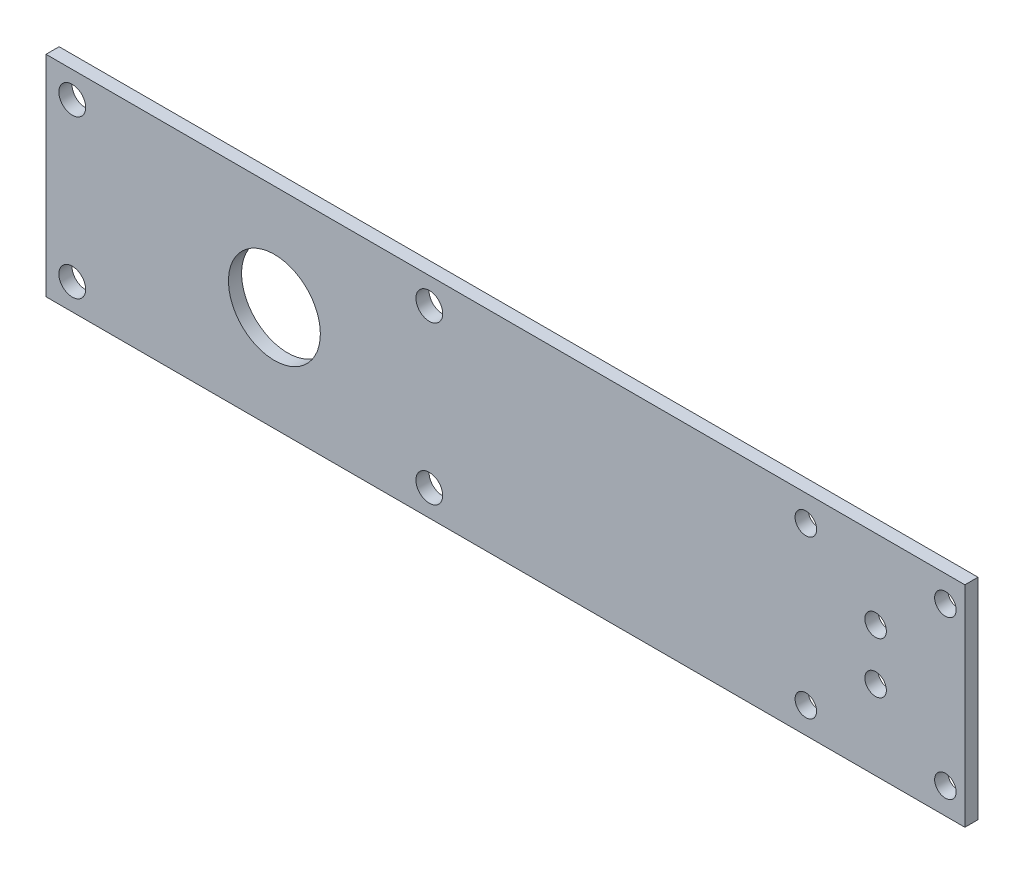
from build123d import *

# Parameters (mm, degrees)
SKETCH1_W           = 350
SKETCH1_H           = 80
BOSS_EXTRUDE1_DEPTH = 5
SKETCH2_R           = 17.5
CUT_EXTRUDE1_DEPTH  = 60
SKETCH3_R           = 5.1
CUT_EXTRUDE2_DEPTH  = 10
SKETCH5_R           = 4.1
CUT_EXTRUDE3_DEPTH  = 267.071418984
SKETCH7_R           = 4.1
CUT_EXTRUDE5_DEPTH  = 267.071418984


with BuildPart() as part:
    # Sketch1 → Boss-Extrude1 (new body)
    with BuildSketch(Plane.XY):
        with Locations((88, 0)):
            Rectangle(SKETCH1_W, SKETCH1_H)
    extrude(amount=BOSS_EXTRUDE1_DEPTH)

    # Sketch2 → Cut-Extrude1 (cut)
    with BuildSketch(Plane(origin=(211.325798344, -35.262222233, -13.242737988), x_dir=(1, 0, 0), z_dir=(0, 0, 1))):
        with Locations((-211.325798344, 35.262222233)):
            Circle(SKETCH2_R)
    extrude(amount=CUT_EXTRUDE1_DEPTH, mode=Mode.SUBTRACT)

    # Sketch3 → Cut-Extrude2 (cut)
    with BuildSketch(Plane(origin=(20.819518943, -63.639721452, 0), x_dir=(1, 0, 0), z_dir=(0, 0, 1))):
        with Locations((-97.819518943, 93.639721452)):
            Circle(SKETCH3_R)
        with Locations(Location((38.180481057, 33.639721452, 0), (0, 0, 180))):
            Circle(SKETCH3_R)
        with Locations((38.180481057, 93.639721452)):
            Circle(SKETCH3_R)
        with Locations(Location((-97.819518943, 33.639721452, 0), (0, 0, 180))):
            Circle(SKETCH3_R)
    extrude(amount=CUT_EXTRUDE2_DEPTH, mode=Mode.SUBTRACT)

    # Sketch5 → Cut-Extrude3 (cut, through all)
    with BuildSketch(Plane.XY):
        with Locations((229, 9.75)):
            Circle(SKETCH5_R)
        with Locations((229, -9.75)):
            Circle(SKETCH5_R)
    extrude(amount=CUT_EXTRUDE3_DEPTH, mode=Mode.SUBTRACT)

    # Sketch7 → Cut-Extrude5 (cut, through all)
    with BuildSketch(Plane.XY):
        with Locations((202.42, 30)):
            Circle(SKETCH7_R)
        with Locations(Location((202.42, -30, 0), (0, 0, 180))):
            Circle(SKETCH7_R)
        with Locations((255.58, -30)):
            Circle(SKETCH7_R)
        with Locations(Location((255.58, 30, 0), (0, 0, 180))):
            Circle(SKETCH7_R)
    extrude(amount=CUT_EXTRUDE5_DEPTH, mode=Mode.SUBTRACT)


solid = part.part
